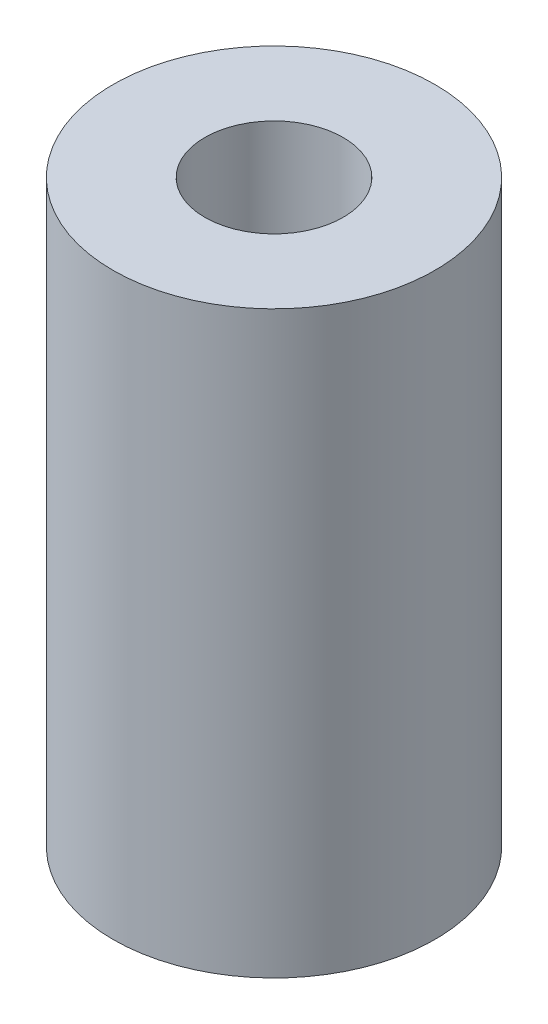
from build123d import *

# Parameters (mm, degrees)
SKETCH_1_R        = 5
SKETCH_1_R_2      = 2.15
EXTRUDE_301_DEPTH = 18


with BuildPart() as part:
    # Эскиз1 → Extrude 301 (new body)
    with BuildSketch(Plane(origin=(0, 0, 0), x_dir=(1, 0, 0), z_dir=(0, 1, 0))):
        with Locations(Location((0, 0, 0), (0, 0, 270))):
            Circle(SKETCH_1_R)
        with Locations(Location((0, 0, 0), (0, 0, 270))):
            Circle(SKETCH_1_R_2, mode=Mode.SUBTRACT)
    extrude(amount=EXTRUDE_301_DEPTH)


solid = part.part
